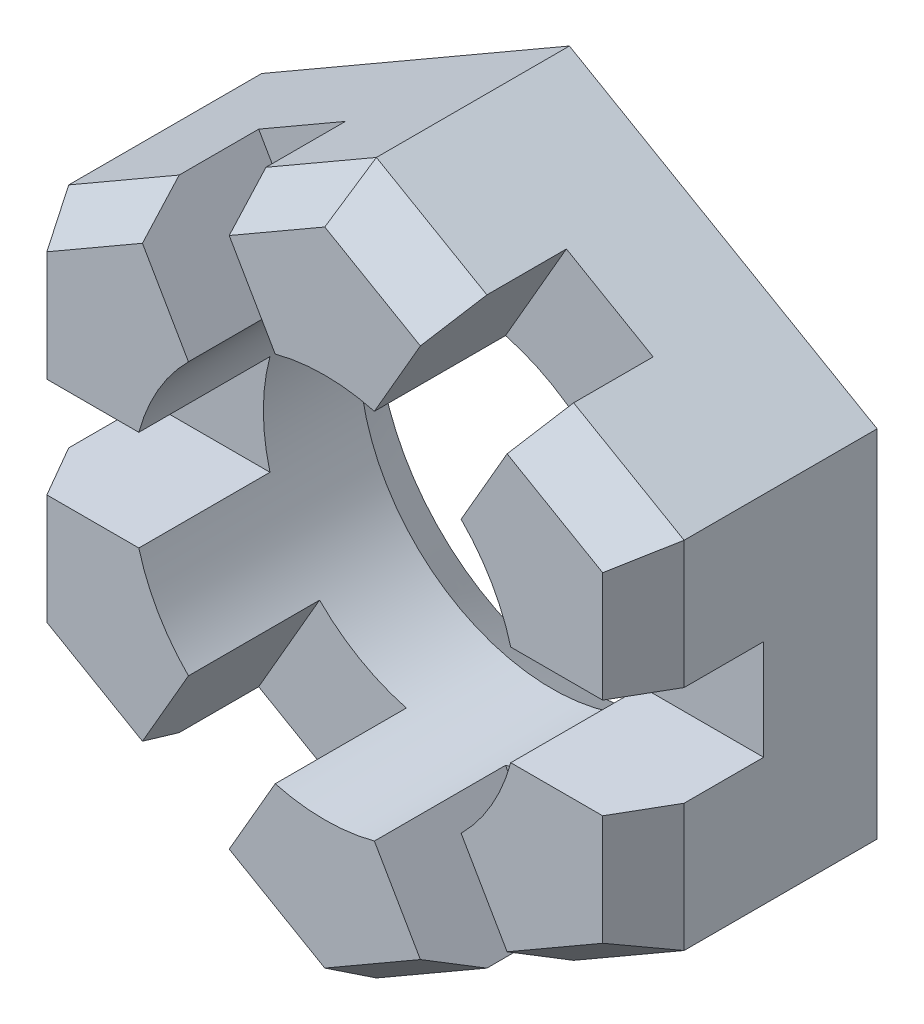
from build123d import *
from OCP.BRepFilletAPI import BRepFilletAPI_MakeChamfer

# Parameters (mm, degrees)
RESSALTO_EXTRUS_O2_DEPTH = 13
ESBO_O3_R                = 9.325
CORTE_EXTRUS_O1_DEPTH    = 27.211129951
ESBO_O4_W                = 8.746276247
ESBO_O4_H                = 4.85
CORTE_EXTRUS_O2_DEPTH    = 6.35
CHANFRO1_SIZE            = 2.5
CHANFRO1_SIZE2           = 1.443375673
CHANFRO2_SIZE            = 2
CHANFRO2_SIZE2           = 1.154700538
CHANFRO3_SIZE            = 2
CHANFRO3_SIZE2           = 1.154700538


with BuildPart() as part:
    # Esboço1 → Ressalto-extrusão2 (new body)
    with BuildSketch(Plane.XY):
        Polygon((0, 17.205038022), (-14.9, 8.602519011), (-14.9, -8.602519011), (0, -17.205038022), (14.9, -8.602519011), (14.9, 8.602519011), align=None)
    extrude(amount=RESSALTO_EXTRUS_O2_DEPTH)

    # Esboço3 → Corte-extrusão1 (cut, through all)
    with BuildSketch(Plane.XY.offset(13)):
        Circle(ESBO_O3_R)
    extrude(amount=-CORTE_EXTRUS_O1_DEPTH, mode=Mode.SUBTRACT)

    # Esboço4 → Corte-extrusão2 (cut)
    with BuildSketch(Plane.XY.offset(13)):
        with Locations((-10.526861876, 0)):
            Rectangle(ESBO_O4_W, ESBO_O4_H)
        Polygon((-5.349888396, 14.116278516), (-9.550111604, 11.691278516), (-5.176973481, 4.116781098), (-0.976750273, 6.541781098), align=None)
        Polygon((9.550111604, 11.691278516), (5.349888396, 14.116278516), (0.976750273, 6.541781098), (5.176973481, 4.116781098), align=None)
        with Locations((10.526861876, 0)):
            Rectangle(ESBO_O4_W, ESBO_O4_H)
        Polygon((5.349888396, -14.116278516), (9.550111604, -11.691278516), (5.176973481, -4.116781098), (0.976750273, -6.541781098), align=None)
        Polygon((-9.550111604, -11.691278516), (-5.349888396, -14.116278516), (-0.976750273, -6.541781098), (-5.176973481, -4.116781098), align=None)
    extrude(amount=-CORTE_EXTRUS_O2_DEPTH, mode=Mode.SUBTRACT)

    # Chanfro1: one chamfer whose edges measure the first distance from different faces: ONE call of the kernel's chamfer builder (chamfer() names one face for all edges)
    chanfro1_edges_1 = [part.edges().sort_by_distance(p)[0] for p in [
        (-14.9, 5.513759505, 13),
        (-14.9, -5.513759505, 13),
    ]]
    chanfro1_side_1 = [part.faces().sort_by_distance(p)[0] for p in [
        (-14.9, 0, 5.969058161),
    ]]
    chanfro1_edges_2 = [part.edges().sort_by_distance(p)[0] for p in [
        (-2.674944198, -15.660658269, 13),
        (-12.225055802, -10.146898764, 13),
    ]]
    chanfro1_side_2 = [part.faces().sort_by_distance(p)[0] for p in [
        (-7.45, -12.903778516, 5.969058161),
    ]]
    chanfro1_edges_3 = [part.edges().sort_by_distance(p)[0] for p in [
        (2.674944198, -15.660658269, 13),
        (12.225055802, -10.146898764, 13),
    ]]
    chanfro1_side_3 = [part.faces().sort_by_distance(p)[0] for p in [
        (7.45, -12.903778516, 5.969058161),
    ]]
    chanfro1_edges_4 = [part.edges().sort_by_distance(p)[0] for p in [
        (14.9, -5.513759505, 13),
        (14.9, 5.513759505, 13),
    ]]
    chanfro1_side_4 = [part.faces().sort_by_distance(p)[0] for p in [
        (14.9, 0, 5.969058161),
    ]]
    chanfro1_edges_5 = [part.edges().sort_by_distance(p)[0] for p in [
        (12.225055802, 10.146898764, 13),
        (2.674944198, 15.660658269, 13),
    ]]
    chanfro1_side_5 = [part.faces().sort_by_distance(p)[0] for p in [
        (7.45, 12.903778516, 5.969058161),
    ]]
    chanfro1_edges_6 = [part.edges().sort_by_distance(p)[0] for p in [
        (-12.225055802, 10.146898764, 13),
        (-2.674944198, 15.660658269, 13),
    ]]
    chanfro1_side_6 = [part.faces().sort_by_distance(p)[0] for p in [
        (-7.45, 12.903778516, 5.969058161),
    ]]
    chanfro1 = BRepFilletAPI_MakeChamfer(part.part.solid().wrapped)
    for e in chanfro1_edges_1:
        chanfro1.Add(CHANFRO1_SIZE, CHANFRO1_SIZE2, e.wrapped, chanfro1_side_1[0].wrapped)  # the first distance lies on this face
    for e in chanfro1_edges_2:
        chanfro1.Add(CHANFRO1_SIZE, CHANFRO1_SIZE2, e.wrapped, chanfro1_side_2[0].wrapped)  # the first distance lies on this face
    for e in chanfro1_edges_3:
        chanfro1.Add(CHANFRO1_SIZE, CHANFRO1_SIZE2, e.wrapped, chanfro1_side_3[0].wrapped)  # the first distance lies on this face
    for e in chanfro1_edges_4:
        chanfro1.Add(CHANFRO1_SIZE, CHANFRO1_SIZE2, e.wrapped, chanfro1_side_4[0].wrapped)  # the first distance lies on this face
    for e in chanfro1_edges_5:
        chanfro1.Add(CHANFRO1_SIZE, CHANFRO1_SIZE2, e.wrapped, chanfro1_side_5[0].wrapped)  # the first distance lies on this face
    for e in chanfro1_edges_6:
        chanfro1.Add(CHANFRO1_SIZE, CHANFRO1_SIZE2, e.wrapped, chanfro1_side_6[0].wrapped)  # the first distance lies on this face
    add(Compound.cast(chanfro1.Shape()), mode=Mode.REPLACE)

    # Chanfro2
    chanfro2_edges = [part.edges().sort_by_distance(p)[0] for p in [
        (-9.325, 0, 0),
    ]]
    chanfro2_side = [part.faces().sort_by_distance(p)[0] for p in [
        (-9.325, 0, 6.5),
    ]]
    chamfer(chanfro2_edges, length=CHANFRO2_SIZE, length2=CHANFRO2_SIZE2, reference=chanfro2_side[0])

    # Chanfro3
    chanfro3_edges = [part.edges().sort_by_distance(p)[0] for p in [
        (14.9, 0, 0),
        (7.45, -12.903778516, 0),
        (-7.45, -12.903778516, 0),
        (-14.9, 0, 0),
        (-7.45, 12.903778516, 0),
        (7.45, 12.903778516, 0),
    ]]
    chanfro3_side = [part.faces().sort_by_distance(p)[0] for p in [
        (-10.934903057, 0, 0),
    ]]
    chamfer(chanfro3_edges, length=CHANFRO3_SIZE, length2=CHANFRO3_SIZE2, reference=chanfro3_side[0])


solid = part.part
